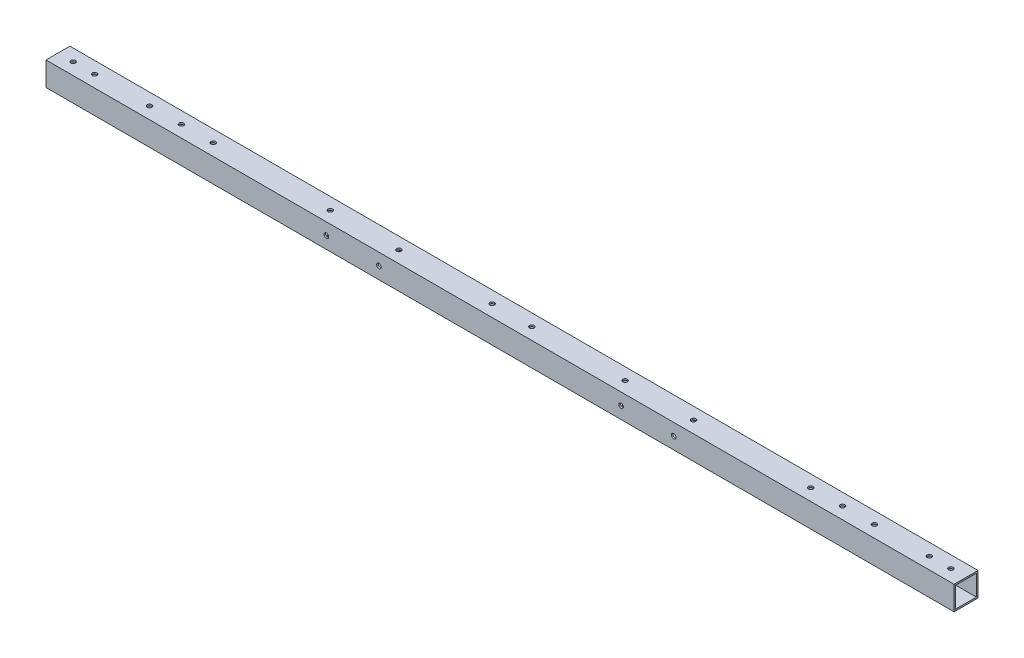
from build123d import *

# Parameters (mm, degrees)
SKETCH_1_W          = 15
SKETCH_1_H          = 15
SKETCH_1_W_2        = 13
SKETCH_1_H_2        = 13
EXTRUDE_1_DEPTH     = 570
SKETCH_2_R          = 1.45
CUT_EXTRUDE_1_DEPTH = 571.246657158
SKETCH_3_R          = 1.45
CUT_EXTRUDE_2_DEPTH = 571.246657158


with BuildPart() as part:
    # 草图1 → 凸台-拉伸1 (new body)
    with BuildSketch(Plane(origin=(0, 0, 0), x_dir=(0, 0, -1), z_dir=(1, 0, 0))):
        Rectangle(SKETCH_1_W, SKETCH_1_H)
        Rectangle(SKETCH_1_W_2, SKETCH_1_H_2, mode=Mode.SUBTRACT)
    extrude(amount=EXTRUDE_1_DEPTH)

    # 草图2 → 切除-拉伸1 (cut, through all)
    with BuildSketch(Plane(origin=(0, 7.5, 0), x_dir=(1, 0, 0), z_dir=(0, 1, 0))):
        with Locations(Location((560.5, 0, 0), (0, 0, 270))):
            Circle(SKETCH_2_R)
        with Locations(Location((547, 0, 0), (0, 0, 270))):
            Circle(SKETCH_2_R)
        with Locations(Location((399, 0, 0), (0, 0, 270))):
            Circle(SKETCH_2_R)
        with Locations(Location((356, 0, 0), (0, 0, 270))):
            Circle(SKETCH_2_R)
        with Locations(Location((214, 0, 0), (0, 0, 270))):
            Circle(SKETCH_2_R)
        with Locations(Location((171, 0, 0), (0, 0, 270))):
            Circle(SKETCH_2_R)
        with Locations(Location((23, 0, 0), (0, 0, 270))):
            Circle(SKETCH_2_R)
        with Locations(Location((9.5, 0, 0), (0, 0, 270))):
            Circle(SKETCH_2_R)
        with Locations(Location((472.5, 0, 0), (0, 0, 270))):
            Circle(SKETCH_2_R)
        with Locations(Location((57.5, 0, 0), (0, 0, 270))):
            Circle(SKETCH_2_R)
        with Locations(Location((77.5, 0, 0), (0, 0, 270))):
            Circle(SKETCH_2_R)
        with Locations(Location((492.5, 0, 0), (0, 0, 270))):
            Circle(SKETCH_2_R)
        with Locations(Location((512.5, 0, 0), (0, 0, 270))):
            Circle(SKETCH_2_R)
        with Locations(Location((272.5, 0, 0), (0, 0, 270))):
            Circle(SKETCH_2_R)
        with Locations(Location((297.5, 0, 0), (0, 0, 270))):
            Circle(SKETCH_2_R)
        with Locations(Location((97.5, 0, 0), (0, 0, 270))):
            Circle(SKETCH_2_R)
    extrude(amount=-CUT_EXTRUDE_1_DEPTH, mode=Mode.SUBTRACT)

    # 草图3 → 切除-拉伸2 (cut, through all)
    with BuildSketch(Plane(origin=(0, 0, -7.5), x_dir=(-1, 0, 0), z_dir=(0, 0, -1))):
        with Locations((-176, 0)):
            Circle(SKETCH_3_R)
        with Locations((-209, 0)):
            Circle(SKETCH_3_R)
        with Locations((-361, 0)):
            Circle(SKETCH_3_R)
        with Locations((-394, 0)):
            Circle(SKETCH_3_R)
    extrude(amount=-CUT_EXTRUDE_2_DEPTH, mode=Mode.SUBTRACT)


solid = part.part
